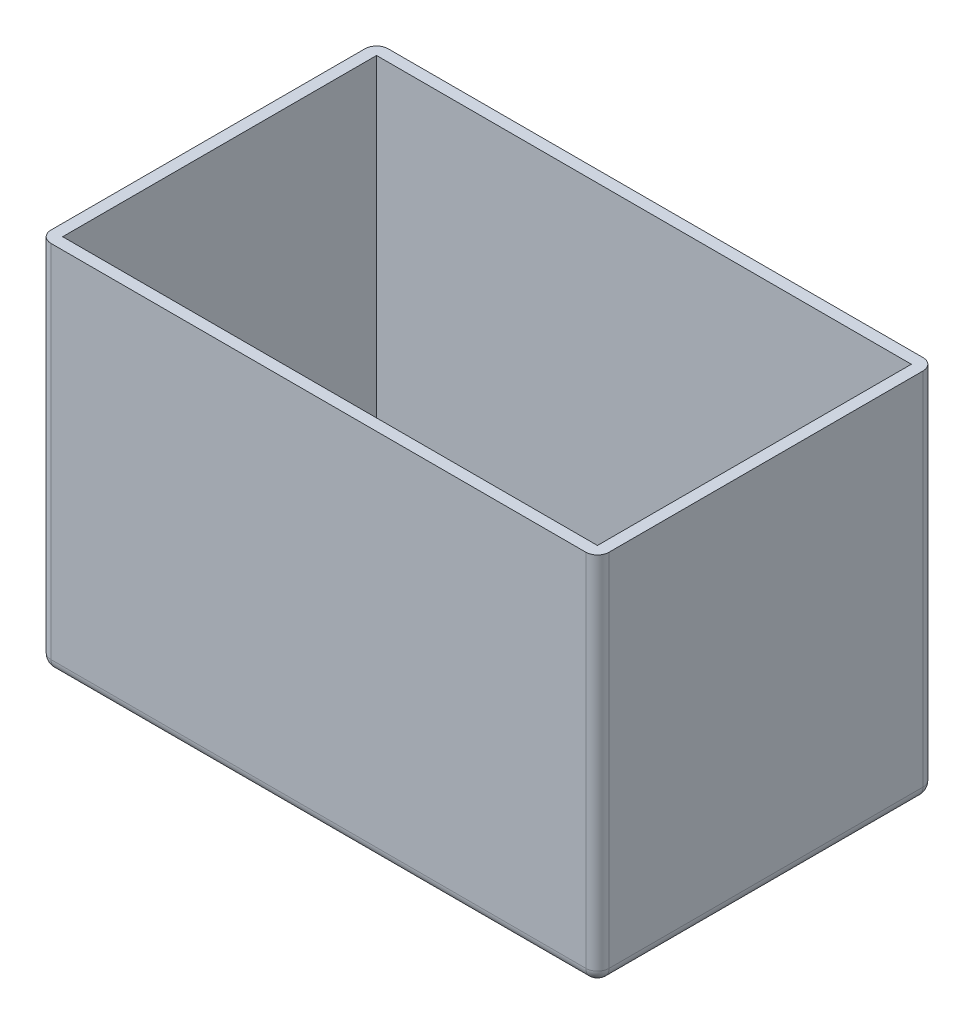
from build123d import *

# Parameters (mm, degrees)
SKETCH_1_W          = 48
SKETCH_1_H          = 29
EXTRUDE_1_DEPTH     = 32
SKETCH_4_W          = 46
SKETCH_4_H          = 27
CUT_EXTRUDE_1_DEPTH = 31
FILLET_1_R          = 1
SKETCH_5_R          = 8
CUT_EXTRUDE_2_DEPTH = 1


with BuildPart() as part:
    # ｽｹｯﾁ1 → ﾎﾞｽ - 押し出し1 (new body)
    with BuildSketch(Plane(origin=(0, 0, 0), x_dir=(1, 0, 0), z_dir=(0, 1, 0))):
        with Locations((-8.709727642, 40.94775)):
            Rectangle(SKETCH_1_W, SKETCH_1_H)
    extrude(amount=EXTRUDE_1_DEPTH)

    # ｽｹｯﾁ4 → ｶｯﾄ - 押し出し1 (cut)
    with BuildSketch(Plane(origin=(0, 32, 0), x_dir=(1, 0, 0), z_dir=(0, 1, 0))):
        with Locations((-8.709727642, 40.94775)):
            Rectangle(SKETCH_4_W, SKETCH_4_H)
    extrude(amount=-CUT_EXTRUDE_1_DEPTH, mode=Mode.SUBTRACT)

    # ﾌｨﾚｯﾄ1
    fillet_1_edges = [part.edges().sort_by_distance(p)[0] for p in [
        (-8.709727642, 0, -55.44775),
        (15.290272358, 0, -40.94775),
        (-8.709727642, 0, -26.44775),
        (-32.709727642, 0, -40.94775),
        (-32.709727642, 16, -55.44775),
        (15.290272358, 16, -55.44775),
        (15.290272358, 16, -26.44775),
        (-32.709727642, 16, -26.44775),
    ]]
    fillet(fillet_1_edges, radius=FILLET_1_R)

    # ｽｹｯﾁ5 → ｶｯﾄ - 押し出し2 (cut)
    with BuildSketch(Plane(origin=(0, 0, 0), x_dir=(-1, 0, 0), z_dir=(0, -1, 0))):
        with Locations(Location((-3.260272358, 44.346563504, 0), (0, 0, 90))):
            Circle(SKETCH_5_R)
        with Locations(Location((22.339727642, 44.346653581, 0), (0, 0, 90))):
            Circle(SKETCH_5_R)
    extrude(amount=-CUT_EXTRUDE_2_DEPTH, mode=Mode.SUBTRACT)


solid = part.part
